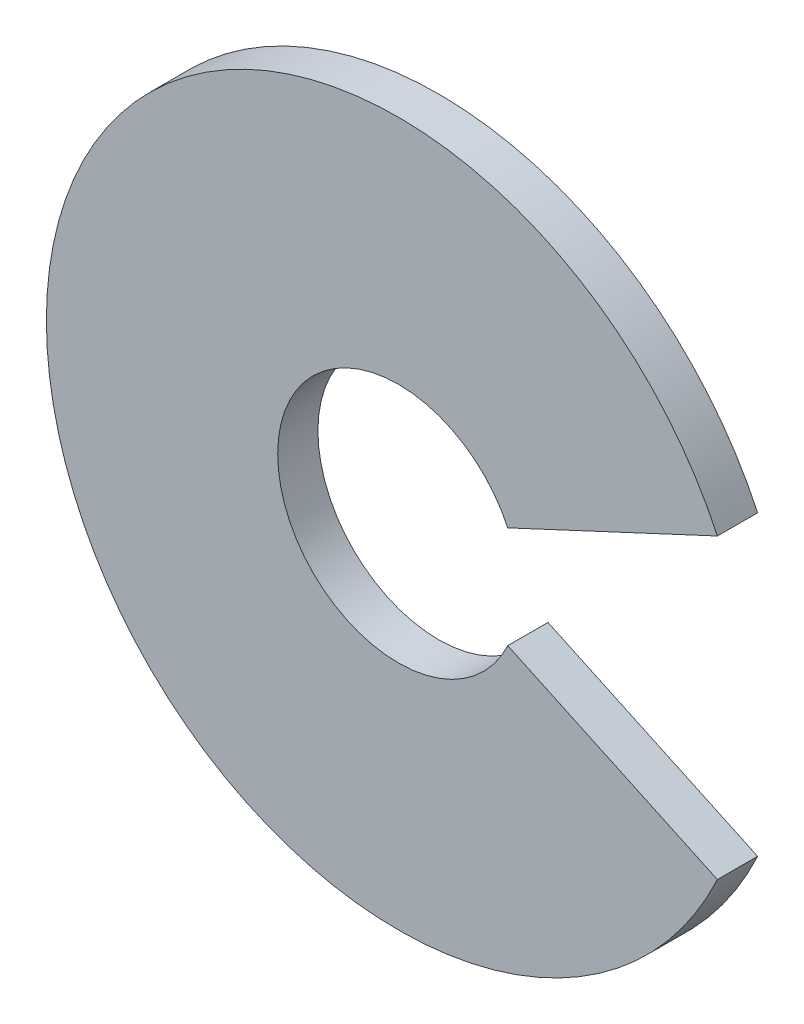
from build123d import *

# Parameters (mm, degrees)
EXTRUDE_1_DEPTH = 0.2


with BuildPart() as part:
    # 草图1 → 凸台-拉伸1 (new, symmetric)
    with BuildSketch(Plane.XY):
        with BuildLine():
            Line((3.172077255, -1.479163916), (1.087569344, -0.507141914))
            ThreePointArc((1.087569344, -0.507141914), (-1.2, 0), (1.087569344, 0.507141914))
            Line((1.087569344, 0.507141914), (3.172077255, 1.479163916))
            ThreePointArc((3.172077255, 1.479163916), (-3.5, 0), (3.172077255, -1.479163916))
        make_face()
    extrude(amount=EXTRUDE_1_DEPTH, both=True)


solid = part.part
